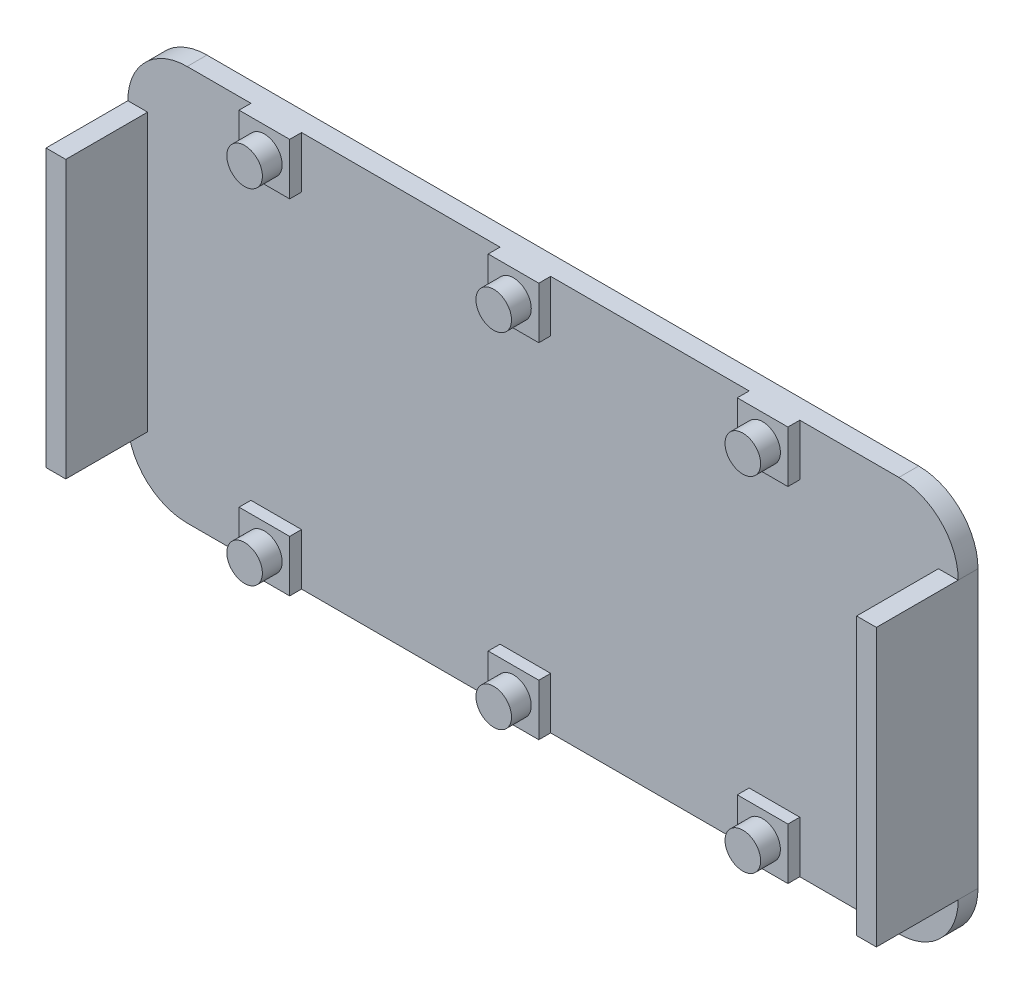
from build123d import *

# Parameters (mm, degrees)
BOSS_EXTRUDE1_DEPTH = 5
SKETCH3_W           = 5
SKETCH3_H           = 70
BOSS_EXTRUDE3_DEPTH = 20.7
SKETCH2_W           = 12.8
SKETCH2_H           = 13.045671514
BOSS_EXTRUDE4_DEPTH = 3
SKETCH4_R           = 4.5
BOSS_EXTRUDE5_DEPTH = 5


with BuildPart() as part:
    # Sketch1 → Boss-Extrude1 (new body)
    with BuildSketch(Plane.XY):
        with BuildLine():
            Line((-90, -50), (90, -50))
            ThreePointArc((90, -50), (100.606601718, -45.606601718), (105, -35))
            Line((105, -35), (105, 35))
            ThreePointArc((105, 35), (100.606601718, 45.606601718), (90, 50))
            Line((90, 50), (-90, 50))
            ThreePointArc((-90, 50), (-100.606601718, 45.606601718), (-105, 35))
            Line((-105, 35), (-105, -35))
            ThreePointArc((-105, -35), (-100.606601718, -45.606601718), (-90, -50))
        make_face()
    extrude(amount=BOSS_EXTRUDE1_DEPTH)

    # Sketch3 → Boss-Extrude3 (add)
    with BuildSketch(Plane.XY.offset(5)):
        with Locations((102.5, 0)):
            Rectangle(SKETCH3_W, SKETCH3_H)
        with Locations((-102.5, 0)):
            Rectangle(SKETCH3_W, SKETCH3_H)
    extrude(amount=BOSS_EXTRUDE3_DEPTH)

    # Sketch2 → Boss-Extrude4 (add)
    with BuildSketch(Plane.XY.offset(5)):
        with Locations((-67.473686504, 43.477164243)):
            Rectangle(SKETCH2_W, SKETCH2_H)
        with Locations((-4.473686504, 43.477164243)):
            Rectangle(SKETCH2_W, SKETCH2_H)
        with Locations((58.526313496, 43.477164243)):
            Rectangle(SKETCH2_W, SKETCH2_H)
        with Locations((-67.473686504, -43.477164243)):
            Rectangle(SKETCH2_W, SKETCH2_H)
        with Locations((-4.473686504, -43.477164243)):
            Rectangle(SKETCH2_W, SKETCH2_H)
        with Locations((58.526313496, -43.477164243)):
            Rectangle(SKETCH2_W, SKETCH2_H)
    extrude(amount=BOSS_EXTRUDE4_DEPTH)

    # Sketch4 → Boss-Extrude5 (add)
    with BuildSketch(Plane.XY.offset(8)):
        with Locations(Location((-67.473686504, 43.477164243, 0), (0, 0, 180))):
            Circle(SKETCH4_R)
        with Locations((-4.473686504, 43.477164243)):
            Circle(SKETCH4_R)
        with Locations((58.526313496, 43.477164243)):
            Circle(SKETCH4_R)
        with Locations(Location((58.526313496, -43.477164243, 0), (0, 0, 180))):
            Circle(SKETCH4_R)
        with Locations(Location((-4.473686504, -43.477164243, 0), (0, 0, 180))):
            Circle(SKETCH4_R)
        with Locations(Location((-67.473686504, -43.477164243, 0), (0, 0, 180))):
            Circle(SKETCH4_R)
    extrude(amount=BOSS_EXTRUDE5_DEPTH)


solid = part.part
